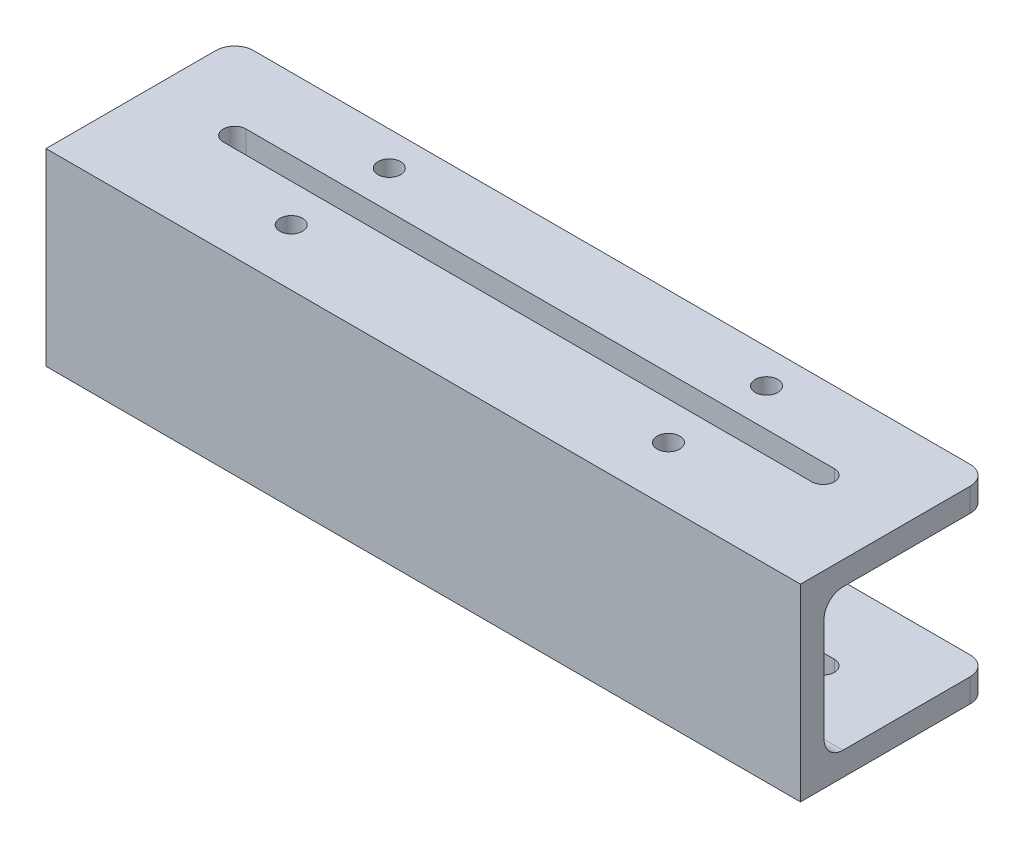
from build123d import *

# Parameters (mm, degrees)
SKETCH1_W           = 101.6
SKETCH1_H           = 25.4
BOSS_EXTRUDE1_DEPTH = 25.4
SKETCH2_W           = 101.6
SKETCH2_H           = 19.05
CUT_EXTRUDE1_DEPTH  = 22.225
CUT_EXTRUDE2_DEPTH  = 25.4
SKETCH5_R           = 1.524
CUT_EXTRUDE4_DEPTH  = 3.175
CHAMFER1_SIZE       = 0.762
FILLET1_R           = 2.54
FILLET2_R           = 2.54


with BuildPart() as part:
    # Sketch1 → Boss-Extrude1 (new body)
    with BuildSketch(Plane(origin=(0, 0, 0), x_dir=(1, 0, 0), z_dir=(0, 1, 0))):
        with Locations((6.015789474, 0.297076023)):
            Rectangle(SKETCH1_W, SKETCH1_H)
    extrude(amount=BOSS_EXTRUDE1_DEPTH)

    # Sketch2 → Cut-Extrude1 (cut)
    with BuildSketch(Plane(origin=(0, 0, -12.997076023), x_dir=(-1, 0, 0), z_dir=(0, 0, -1))):
        with Locations((-6.015789474, 12.7)):
            Rectangle(SKETCH2_W, SKETCH2_H)
    extrude(amount=-CUT_EXTRUDE1_DEPTH, mode=Mode.SUBTRACT)

    # Sketch4 → Cut-Extrude2 (cut)
    with BuildSketch(Plane(origin=(0, 25.4, 0), x_dir=(1, 0, 0), z_dir=(0, 1, 0))):
        with BuildLine():
            Line((-33.608210526, 0.297076023), (45.639789474, 0.297076023))
            ThreePointArc((45.639789474, 0.297076023), (47.163789474, 1.821076023), (45.639789474, 3.345076023))
            Line((45.639789474, 3.345076023), (-33.608210526, 3.345076023))
            ThreePointArc((-33.608210526, 3.345076023), (-35.132210526, 1.821076023), (-33.608210526, 0.297076023))
        make_face()
    extrude(amount=-CUT_EXTRUDE2_DEPTH, mode=Mode.SUBTRACT)

    # Sketch5 → Cut-Extrude4 (cut)
    with BuildSketch(Plane(origin=(0, 25.4, 0), x_dir=(1, 0, 0), z_dir=(0, 1, 0))):
        with Locations(Location((-19.384210526, 8.425076023, 0), (0, 0, 270))):
            Circle(SKETCH5_R)
        with Locations(Location((-19.384210526, -4.782923977, 0), (0, 0, 270))):
            Circle(SKETCH5_R)
        with Locations(Location((31.415789474, 8.425076023, 0), (0, 0, 270))):
            Circle(SKETCH5_R)
        with Locations(Location((31.415789474, -4.782923977, 0), (0, 0, 270))):
            Circle(SKETCH5_R)
    extrude(amount=-CUT_EXTRUDE4_DEPTH, mode=Mode.SUBTRACT)

    # Chamfer1
    chamfer1_edges = [part.edges().sort_by_distance(p)[0] for p in [
        (-19.384210526, 22.225, -9.949076023),
        (-19.384210526, 22.225, 3.258923977),
        (31.415789474, 22.225, -9.949076023),
        (31.415789474, 22.225, 3.258923977),
    ]]
    chamfer(chamfer1_edges, length=CHAMFER1_SIZE)

    # Fillet1
    fillet1_edges = [part.edges().sort_by_distance(p)[0] for p in [
        (6.015789474, 22.225, 9.227923977),
        (6.015789474, 3.175, 9.227923977),
    ]]
    fillet(fillet1_edges, radius=FILLET1_R)

    # Fillet2
    fillet2_edges = [part.edges().sort_by_distance(p)[0] for p in [
        (-44.784210526, 1.5875, -12.997076023),
        (56.815789474, 1.5875, -12.997076023),
        (-44.784210526, 23.8125, -12.997076023),
        (56.815789474, 23.8125, -12.997076023),
    ]]
    fillet(fillet2_edges, radius=FILLET2_R)


solid = part.part
